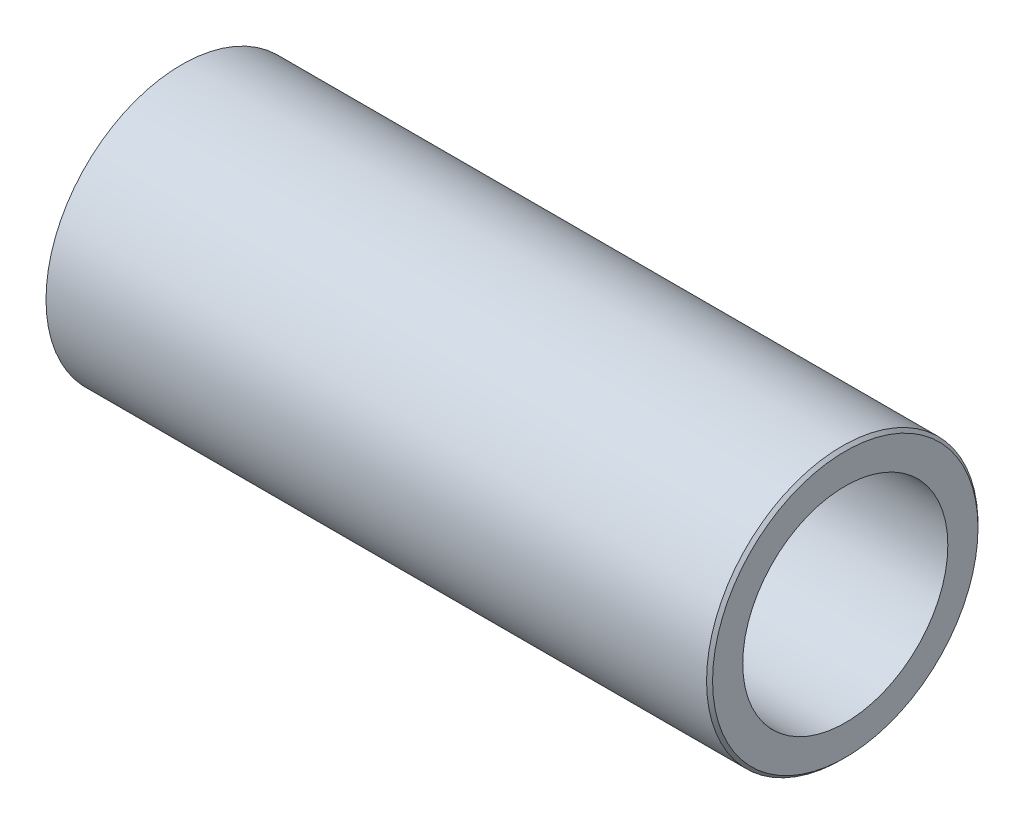
from build123d import *

# Parameters (mm, degrees)
CHAMFER1_SIZE = 0.5


with BuildPart() as part:
    # Sketch1 → Revolve1 (revolve)
    with BuildSketch(Plane.XY, mode=Mode.PRIVATE) as revolve1_sk:
        Polygon((-64, 9), (-60, 9), (-60, 12), (0, 12), (0, 17), (46, 17), (46, 22.5), (-64, 22.5), align=None)
    revolve(revolve1_sk.sketch.rotate(Axis((-14.4, 0, 0), (1, 0, 0)), 90), axis=Axis((-14.4, 0, 0), (1, 0, 0)))

    # Chamfer1
    chamfer1_edges = [part.edges().sort_by_distance(p)[0] for p in [
        (46, 0, -22.5),
    ]]
    chamfer(chamfer1_edges, length=CHAMFER1_SIZE)


solid = part.part
